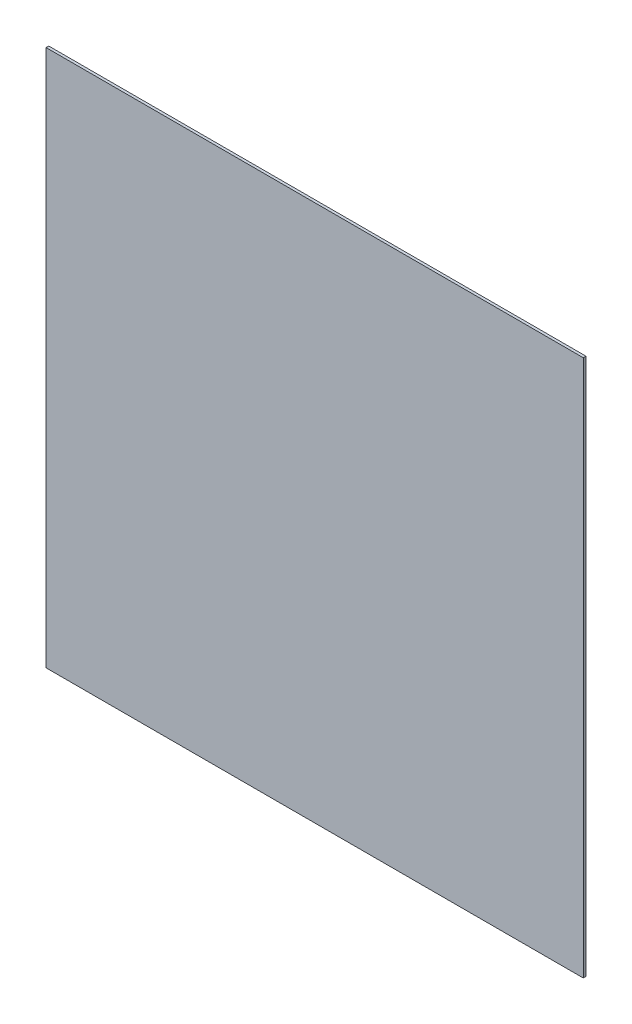
from build123d import *

# Parameters (mm, degrees)
SKETCH1_W      = 1000
SKETCH1_H      = 1000
EXTRUDE1_DEPTH = 5


with BuildPart() as part:
    # Sketch1 → Extrude1 (new body)
    with BuildSketch(Plane.XY):
        with Locations((0, -508)):
            Rectangle(SKETCH1_W, SKETCH1_H)
    extrude(amount=-EXTRUDE1_DEPTH)


solid = part.part
